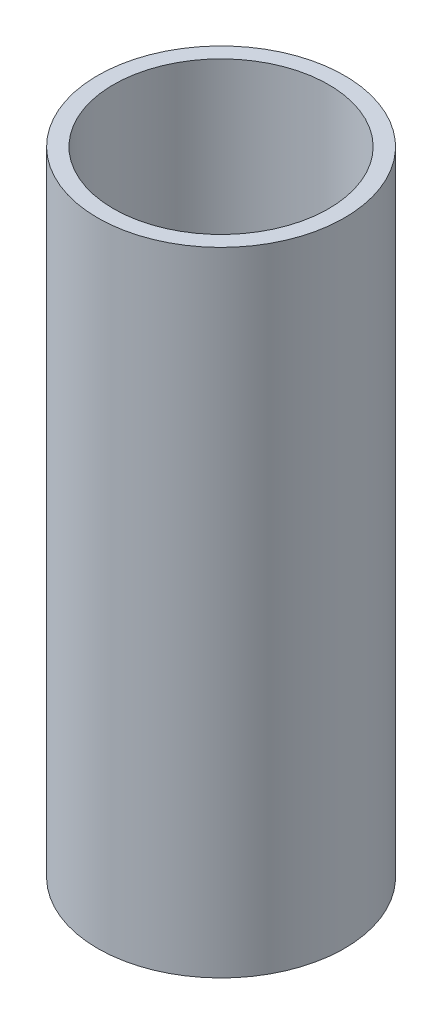
from build123d import *

# Parameters (mm, degrees)
SKETCH1_R           = 5.85
SKETCH1_R_2         = 5.1
BOSS_EXTRUDE1_DEPTH = 30


with BuildPart() as part:
    # Sketch1 → Boss-Extrude1 (new body)
    with BuildSketch(Plane(origin=(0, 0, 0), x_dir=(1, 0, 0), z_dir=(0, 1, 0))):
        with Locations(Location((0, 0, 0), (0, 0, 270))):
            Circle(SKETCH1_R)
        with Locations(Location((0, 0, 0), (0, 0, 270))):
            Circle(SKETCH1_R_2, mode=Mode.SUBTRACT)
    extrude(amount=BOSS_EXTRUDE1_DEPTH)


solid = part.part
